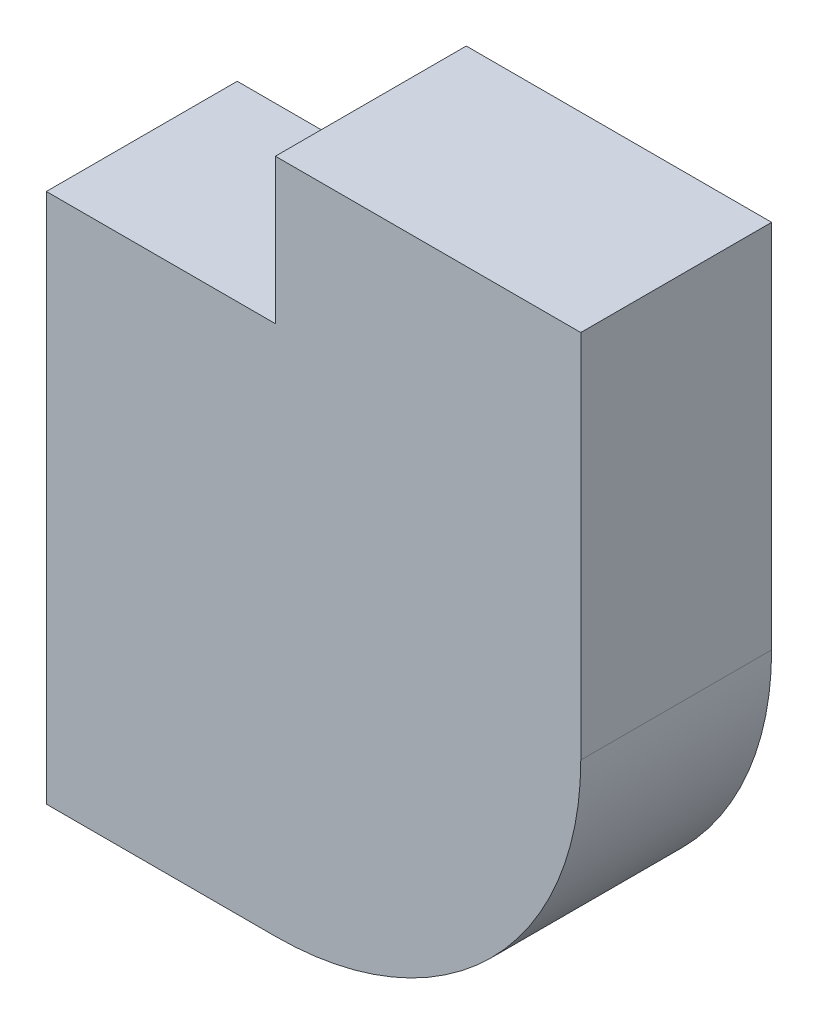
from build123d import *

# Parameters (mm, degrees)
BOSS_EXTRUDE1_DEPTH = 0.125
FILLET1_R           = 0.4


with BuildPart() as part:
    # frame_outline → Boss-Extrude1 (new, symmetric)
    with BuildSketch(Plane.XY):
        Polygon((0, 0), (0, 0.695), (0.3, 0.695), (0.3, 0.885), (0.7, 0.885), (0.7, 0.695), (0.7, 0), align=None)
    extrude(amount=BOSS_EXTRUDE1_DEPTH, both=True)

    # Fillet1
    fillet1_edges = [part.edges().sort_by_distance(p)[0] for p in [
        (0.7, 0, 0),
    ]]
    fillet(fillet1_edges, radius=FILLET1_R)


solid = part.part
